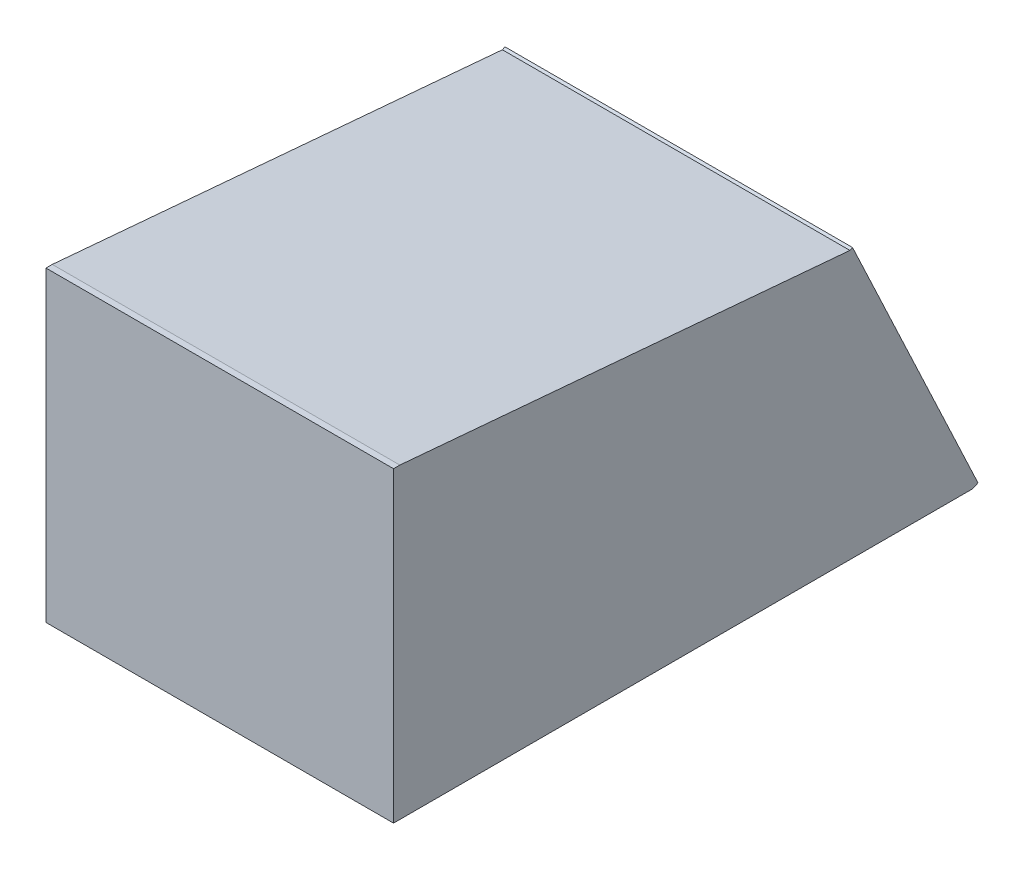
from build123d import *

# Parameters (mm, degrees)
BOSS_EXTRUDE1_DEPTH             = 5
SKETCH2_W                       = 300
SKETCH2_H                       = 390
BOSS_EXTRUDE2_DEPTH             = 5
BOSS_EXTRUDE3_DEPTH             = 5
SKETCH4_W                       = 300
SKETCH4_H                       = 254.322327046
BOSS_EXTRUDE4_DEPTH             = 5
SKETCH7_W                       = 300
SKETCH7_H                       = 264.981182322
BOSS_EXTRUDE7_DEPTH             = 5
BOSS_EXTRUDE7_DIRECTION_2_REACH = 597.625


with BuildPart() as part:
    # Sketch1 → Boss-Extrude1 (new body)
    with BuildSketch(Plane(origin=(0, 0, 0), x_dir=(0, 0, -1), z_dir=(1, 0, 0))):
        Polygon((-247.5, 130), (-247.5, -130), (247.5, -130), (141.03222111, 96.195959421), align=None)
    extrude(amount=BOSS_EXTRUDE1_DEPTH)

    # Sketch2 → Boss-Extrude2 (add)
    with BuildSketch(Plane(origin=(0, 107.651495361, -9.366161466), x_dir=(1, 0, 0), z_dir=(0, 0.9962364643840649, -0.08667702712678799))):
        with Locations((-145, -62.836538462)):
            Rectangle(SKETCH2_W, SKETCH2_H)
    extrude(amount=BOSS_EXTRUDE2_DEPTH)

    # Sketch3 → Boss-Extrude3 (add)
    with BuildSketch(Plane.ZY.offset(295)):
        Polygon((247.5, 130), (-141.03222111, 96.195959421), (-247.5, -130), (247.5, -130), align=None)
    extrude(amount=-BOSS_EXTRUDE3_DEPTH)

    # Sketch4 → Boss-Extrude4 (add)
    with BuildSketch(Plane(origin=(0, 71.789415399, -152.520094452), x_dir=(-1, 0, 0), z_dir=(0, 0.42587111556085877, -0.904783837682211))):
        with Locations((145, -95.863836477)):
            Rectangle(SKETCH4_W, SKETCH4_H)
    extrude(amount=BOSS_EXTRUDE4_DEPTH)

    # Sketch7 → Boss-Extrude7 (add)
    with BuildSketch(Plane.XY.offset(247.5)):
        with Locations((-145, 2.490591161)):
            Rectangle(SKETCH7_W, SKETCH7_H)
    extrude(amount=BOSS_EXTRUDE7_DEPTH)

    # Boss-Extrude7 direction 2: up to this face of the body (flat: up to its plane)
    boss_extrude7_direction_2_end = Plane(part.part.faces().sort_by_distance((-145, 132.490591161, 247.283307432))[0])
    # Sketch7 → Boss-Extrude7 direction 2 (add, up to the picked face)
    with BuildSketch(Plane.XY.offset(247.5), mode=Mode.PRIVATE) as boss_extrude7_direction_2_sk1:
        with Locations((-145, 2.490591161)):
            Rectangle(SKETCH7_W, SKETCH7_H)
    boss_extrude7_direction_2_tool1 = split(extrude(boss_extrude7_direction_2_sk1.sketch, amount=-BOSS_EXTRUDE7_DIRECTION_2_REACH, mode=Mode.PRIVATE), bisect_by=boss_extrude7_direction_2_end, keep=Keep.BOTH, mode=Mode.PRIVATE)
    add(boss_extrude7_direction_2_tool1.solids().sort_by(Axis((-145, 2.490591, 247.5), (0, 0, -1)))[0])


solid = part.part
